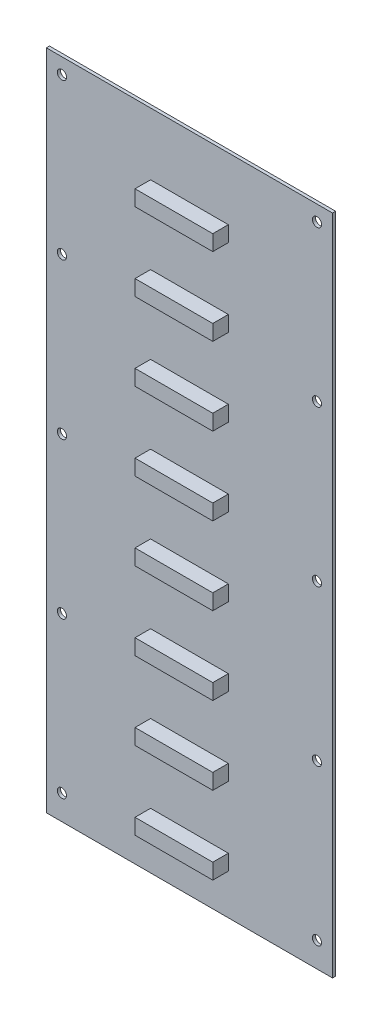
from build123d import *

# Parameters (mm, degrees)
SKETCH1_W                 = 92
SKETCH1_H                 = 213
BOSS_EXTRUDE1_DEPTH       = 1
SKETCH2_W                 = 25
SKETCH2_H                 = 5
BOSS_EXTRUDE2_DEPTH       = 5
F_4_CLEARANCE_HOLE1_D     = 2.9464
F_4_CLEARANCE_HOLE1_DEPTH = 3.175
F_4_CLEARANCE_HOLE1_TIP   = 0.885187864


with BuildPart() as part:
    # Sketch1 → Boss-Extrude1 (new body)
    with BuildSketch(Plane.XY):
        Rectangle(SKETCH1_W, SKETCH1_H)
    extrude(amount=BOSS_EXTRUDE1_DEPTH)

    # Sketch2 → Boss-Extrude2 (add)
    with BuildSketch(Plane.XY.offset(1)):
        with Locations((0, 84)):
            Rectangle(SKETCH2_W, SKETCH2_H)
        with Locations((0, 59)):
            Rectangle(SKETCH2_W, SKETCH2_H)
        with Locations((0, 34)):
            Rectangle(SKETCH2_W, SKETCH2_H)
        with Locations((0, 9)):
            Rectangle(SKETCH2_W, SKETCH2_H)
        with Locations((0, -16)):
            Rectangle(SKETCH2_W, SKETCH2_H)
        with Locations((0, -41)):
            Rectangle(SKETCH2_W, SKETCH2_H)
        with Locations((0, -66)):
            Rectangle(SKETCH2_W, SKETCH2_H)
        with Locations((0, -91)):
            Rectangle(SKETCH2_W, SKETCH2_H)
    extrude(amount=BOSS_EXTRUDE2_DEPTH)

    # #4 Clearance Hole1
    with Locations(Plane.XY.offset(1)):
        with Locations((-41, 101.5), (41, 101.5), (-41, 51.5), (41, 51.5), (-41, 1.5), (41, 1.5), (-41, -48.5), (41, -48.5), (-41, -98.5), (41, -98.5)):
            Hole(F_4_CLEARANCE_HOLE1_D / 2, depth=F_4_CLEARANCE_HOLE1_DEPTH)
            with Locations((0, 0, -(F_4_CLEARANCE_HOLE1_DEPTH + F_4_CLEARANCE_HOLE1_TIP / 2))):  # 118° drill point
                Cone(0, F_4_CLEARANCE_HOLE1_D / 2, F_4_CLEARANCE_HOLE1_TIP, mode=Mode.SUBTRACT)


solid = part.part
